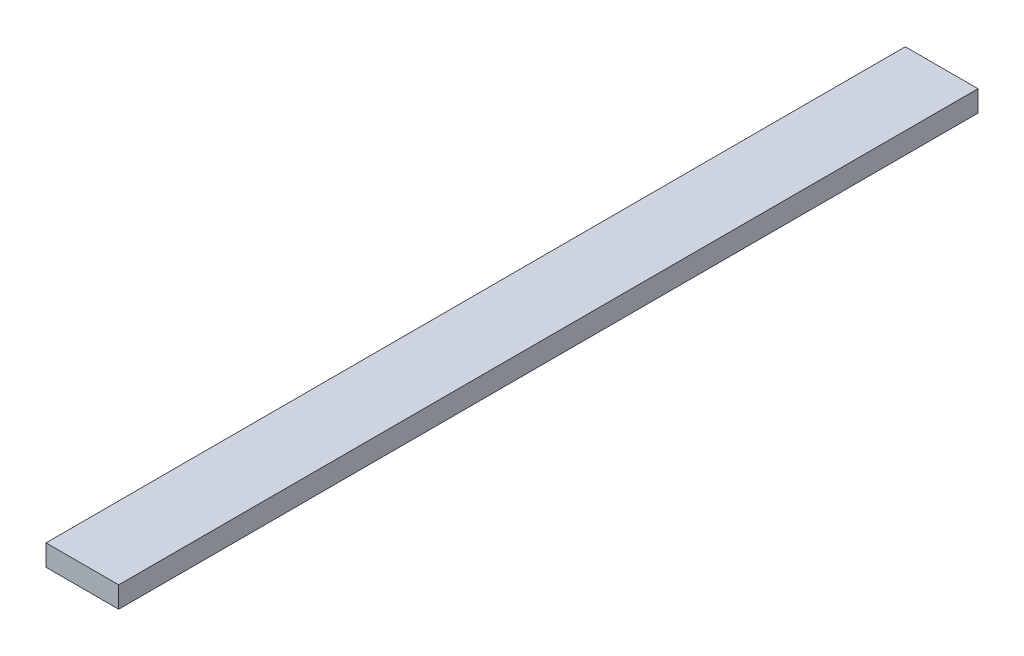
from build123d import *

# Parameters (mm, degrees)
SKETCH1_W           = 13.97
SKETCH1_H           = 165.1
BOSS_EXTRUDE1_DEPTH = 2.54
SKETCH2_W           = 13.97
SKETCH2_H           = 165.1
BOSS_EXTRUDE2_DEPTH = 1.524


with BuildPart() as part:
    # Sketch1 → Boss-Extrude1 (new body)
    with BuildSketch(Plane(origin=(0, 0, 0), x_dir=(1, 0, 0), z_dir=(0, 1, 0))):
        with Locations((0.840787037, 62.759166667)):
            Rectangle(SKETCH1_W, SKETCH1_H)
    extrude(amount=BOSS_EXTRUDE1_DEPTH)

    # Sketch2 → Boss-Extrude2 (add)
    with BuildSketch(Plane(origin=(0, 2.54, 0), x_dir=(1, 0, 0), z_dir=(0, 1, 0))):
        with Locations((0.840787037, 62.759166667)):
            Rectangle(SKETCH2_W, SKETCH2_H)
    extrude(amount=BOSS_EXTRUDE2_DEPTH)


solid = part.part
